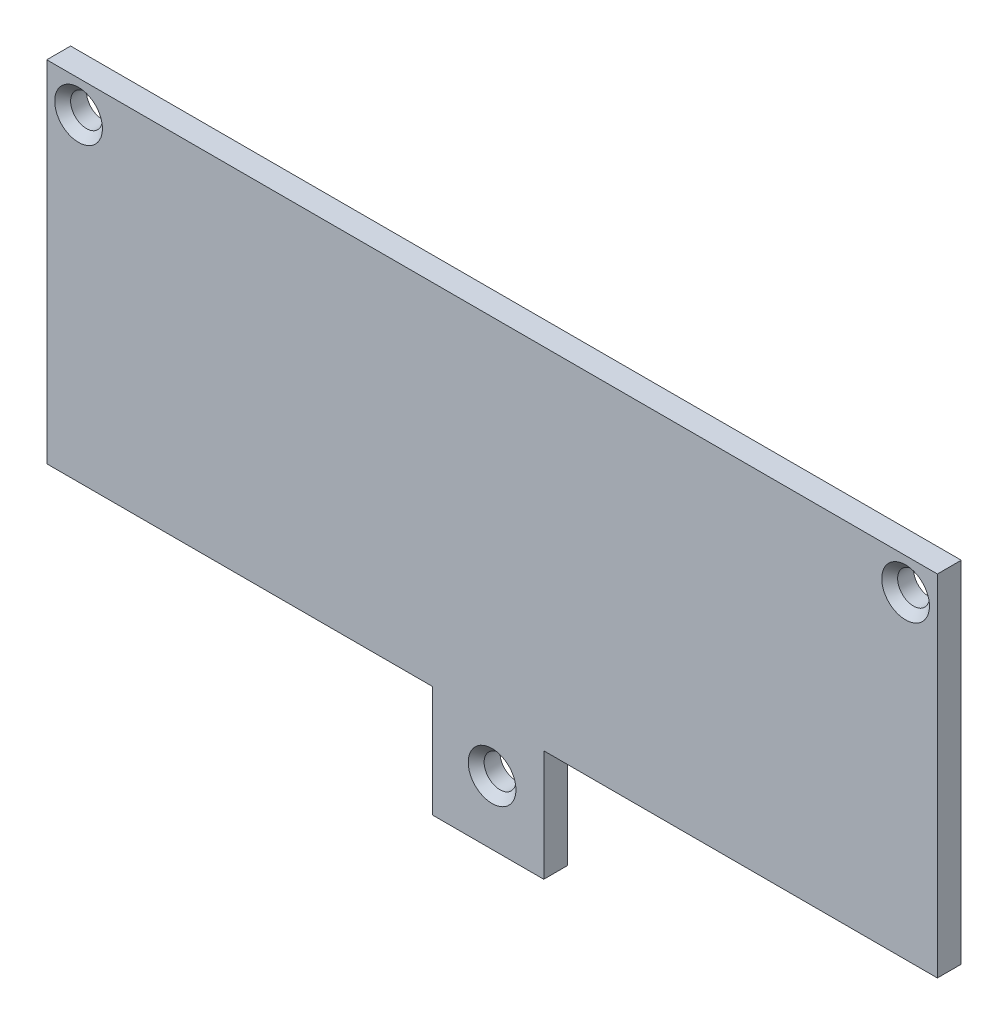
from build123d import *

# Parameters (mm, degrees)
SKETCH_1_W                  = 51
SKETCH_1_H                  = 16
EXTRUDE_1_DEPTH             = 1.5
EXTRUDE_2_DEPTH             = 1.5
FILLET_2_R                  = 3
HOLE_WIZARD_M21_D           = 2
HOLE_WIZARD_M21_CSINK_D     = 3
HOLE_WIZARD_M21_CSINK_ANGLE = 90


with BuildPart() as part:
    # Эскиз1 → Бобышка-Вытянуть1 (new body)
    with BuildSketch(Plane.XY):
        with Locations((25.5, 8)):
            Rectangle(SKETCH_1_W, SKETCH_1_H)
    extrude(amount=EXTRUDE_1_DEPTH)

    # Эскиз2 → Бобышка-Вытянуть2 (add)
    with BuildSketch(Plane.XY.offset(1.5)):
        Polygon((3.5, 20), (47.5, 20), (53.5, 20), (53.5, 19.5), (53.5, -2), (28.75, -2), (28.75, -9), (21.75, -9), (21.75, -2), (-2.5, -2), (-2.5, 19.5), (-2.5, 20), align=None)
    extrude(amount=EXTRUDE_2_DEPTH)

    # Скругление2
    fillet_2_edges = [part.edges().sort_by_distance(p)[0] for p in [
        (0, 0, 0.75),
        (0, 16, 0.75),
        (51, 16, 0.75),
        (51, 0, 0.75),
    ]]
    fillet(fillet_2_edges, radius=FILLET_2_R)

    # Зенковка для  винта с полупотайной головкой M21 (through all)
    with Locations(Plane.XY.offset(3)):
        with Locations((25.5, -5), (-0.5, 18), (51.5, 18)):
            CounterSinkHole(HOLE_WIZARD_M21_D / 2, HOLE_WIZARD_M21_CSINK_D / 2, counter_sink_angle=HOLE_WIZARD_M21_CSINK_ANGLE)


solid = part.part
